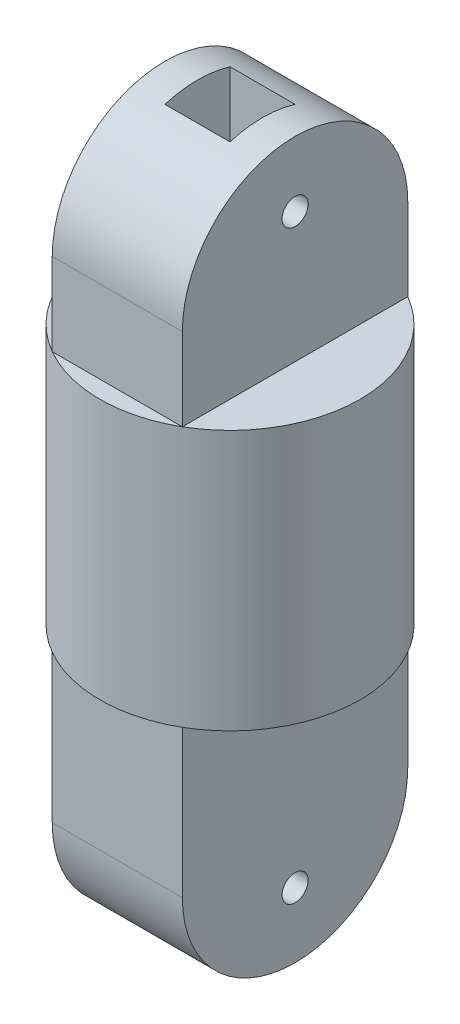
from build123d import *

# Parameters (mm, degrees)
BOSS_EXTRUDE1_DEPTH              = 5
BOSS_EXTRUDE1_DEPTH_BACK         = 5
SKETCH1_R                        = 5
SKETCH2_W                        = 5
SKETCH2_H                        = 8.660254038
BOSS_EXTRUDE2_DEPTH              = 10
CUT_EXTRUDE1_DEPTH               = 10
F_95_0_03937008_DIAMETER_HOLE1_D = 1.000000032
CUT_EXTRUDE2_DEPTH               = 10
CUT_EXTRUDE2_DEPTH_BACK          = 22.213203436
SKETCH7_W                        = 2.5
SKETCH7_H                        = 2.5
SKETCH8_W                        = 5
SKETCH8_H                        = 8.660254038
BOSS_EXTRUDE3_DEPTH              = 7.5
CUT_EXTRUDE3_DEPTH               = 7.5
F_95_0_03937008_DIAMETER_HOLE2_D = 1.000000032
SKETCH13_W                       = 2.5
SKETCH13_H                       = 2.5
CUT_EXTRUDE4_DEPTH               = 7.5


with BuildPart() as part:
    # Sketch1 → Boss-Extrude1 (new, two sides: drawn at the far end of the back side and taken through both)
    with BuildSketch(Plane(origin=(0, 0, 0), x_dir=(1, 0, 0), z_dir=(0, 1, 0)).offset(-BOSS_EXTRUDE1_DEPTH_BACK)):
        Circle(SKETCH1_R)
    extrude(amount=BOSS_EXTRUDE1_DEPTH + BOSS_EXTRUDE1_DEPTH_BACK)

    # Sketch2 → Boss-Extrude2 (add)
    with BuildSketch(Plane(origin=(0, -5, 0), x_dir=(-1, 0, 0), z_dir=(0, -1, 0))):
        Rectangle(SKETCH2_W, SKETCH2_H)
    extrude(amount=BOSS_EXTRUDE2_DEPTH)

    # Sketch3 → Cut-Extrude1 (cut)
    with BuildSketch(Plane.ZY.offset(2.5)):
        with BuildLine():
            Line((4.330127019, -10.66987298), (5.842852499, -10.66987298))
            Line((5.842852499, -10.66987298), (5.842852499, -18.914150706))
            Line((5.842852499, -18.914150706), (-6.856243272, -18.914150706))
            Line((-6.856243272, -18.914150706), (-6.856243272, -10.66987298))
            Line((-6.856243272, -10.66987298), (-4.330127019, -10.66987298))
            ThreePointArc((-4.330127019, -10.66987298), (-3.061862179, -13.731735159), (0, -15))
            ThreePointArc((0, -15), (3.061862179, -13.731735159), (4.330127019, -10.66987298))
        make_face()
    extrude(amount=-CUT_EXTRUDE1_DEPTH, mode=Mode.SUBTRACT)

    # #95 (0.03937008) Diameter Hole1 (through all)
    with Locations(Plane.ZY.offset(2.5)):
        with Locations((0, -12.499999999)):
            Hole(F_95_0_03937008_DIAMETER_HOLE1_D / 2)

    # Sketch7 → Cut-Extrude2 (cut, two sides: drawn at the far end of the back side and taken through both)
    with BuildSketch(Plane(origin=(0, 5, 0), x_dir=(1, 0, 0), z_dir=(0, 1, 0)).offset(-CUT_EXTRUDE2_DEPTH_BACK)):
        Rectangle(SKETCH7_W, SKETCH7_H)
    extrude(amount=CUT_EXTRUDE2_DEPTH + CUT_EXTRUDE2_DEPTH_BACK, mode=Mode.SUBTRACT)

    # Sketch8 → Boss-Extrude3 (add)
    with BuildSketch(Plane(origin=(0, 5, 0), x_dir=(1, 0, 0), z_dir=(0, 1, 0))):
        Rectangle(SKETCH8_W, SKETCH8_H)
    extrude(amount=BOSS_EXTRUDE3_DEPTH)

    # Sketch9 → Cut-Extrude3 (cut)
    with BuildSketch(Plane.ZY.offset(2.5)):
        with BuildLine():
            Line((-4.330127019, 8.16987298), (-5.309333273, 8.16987298))
            Line((-5.309333273, 8.16987298), (-5.309333273, 13.114789022))
            Line((-5.309333273, 13.114789022), (5.138804432, 13.114789022))
            Line((5.138804432, 13.114789022), (5.138804432, 8.16987298))
            Line((5.138804432, 8.16987298), (4.330127019, 8.16987298))
            ThreePointArc((4.330127019, 8.16987298), (0, 12.499999999), (-4.330127019, 8.16987298))
        make_face()
    extrude(amount=-CUT_EXTRUDE3_DEPTH, mode=Mode.SUBTRACT)

    # #95 (0.03937008) Diameter Hole2 (through all)
    with Locations(Plane.ZY.offset(2.5)):
        with Locations((0, 9.999999999)):
            Hole(F_95_0_03937008_DIAMETER_HOLE2_D / 2)

    # Sketch13 → Cut-Extrude4 (cut)
    with BuildSketch(Plane.XZ.offset(-5)):
        Rectangle(SKETCH13_W, SKETCH13_H)
    extrude(amount=-CUT_EXTRUDE4_DEPTH, mode=Mode.SUBTRACT)


solid = part.part
